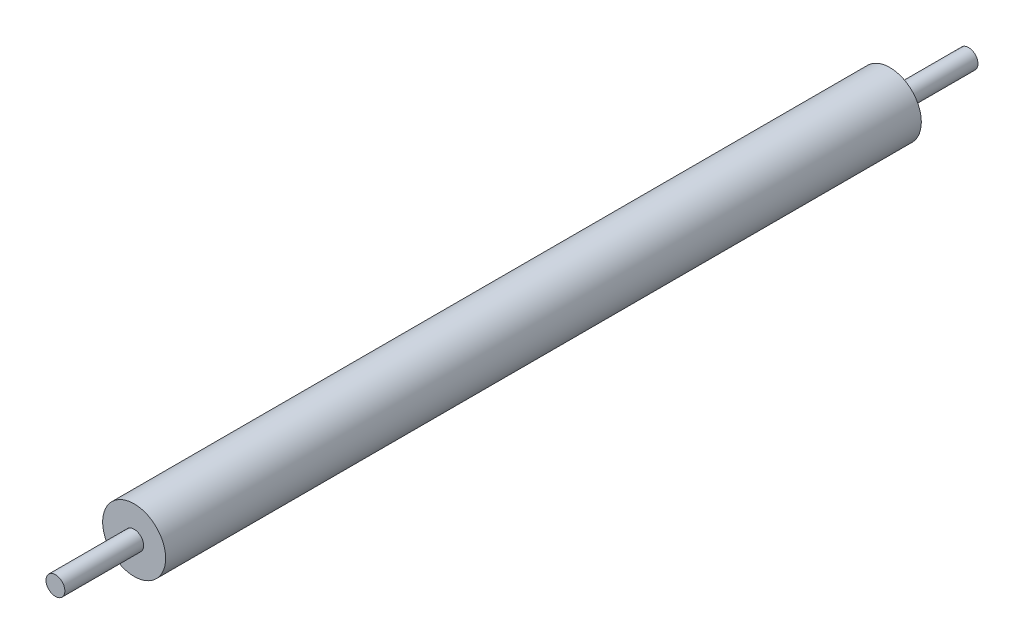
from build123d import *

# Parameters (mm, degrees)
SKETCH1_R           = 50
BOSS_EXTRUDE1_DEPTH = 600
BOSS_EXTRUDE2_DEPTH = 600
BOSS_EXTRUDE4_START = 600
SKETCH6_R           = 15
BOSS_EXTRUDE4_DEPTH = 125


with BuildPart() as part:
    # Sketch1 → Boss-Extrude1 (new, symmetric)
    with BuildSketch(Plane.XY):
        Circle(SKETCH1_R)
    extrude(amount=BOSS_EXTRUDE1_DEPTH, both=True)

    # Sketch4 → Boss-Extrude2 (add, symmetric)
    with BuildSketch(Plane.XY):
        with BuildLine():
            Line((-5, 18.3), (-5, 14.142135624))
            ThreePointArc((-5, 14.142135624), (0, -15), (5, 14.142135624))
            Line((5, 14.142135624), (5, 18.3))
            Line((5, 18.3), (-5, 18.3))
        make_face()
    extrude(amount=BOSS_EXTRUDE2_DEPTH, both=True)

    # Sketch6 → Boss-Extrude4 (add)
    with BuildSketch(Plane.XY.offset(BOSS_EXTRUDE4_START)):
        Circle(SKETCH6_R)
    boss_extrude4 = extrude(amount=BOSS_EXTRUDE4_DEPTH)

    # Mirror1: Boss-Extrude4 across plane
    add(boss_extrude4.mirror(Plane.XY))


solid = part.part
